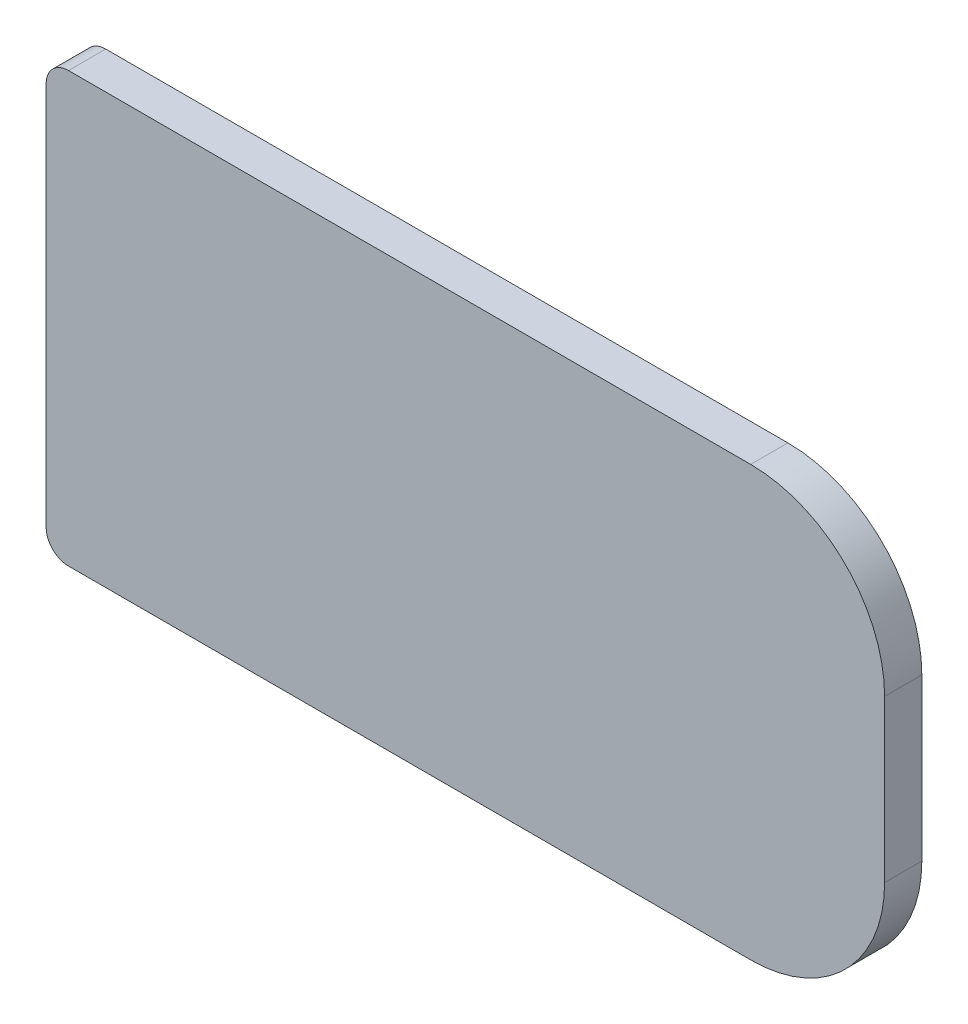
from build123d import *

# Parameters (mm, degrees)
BOSS_EXTRUDE1_DEPTH = 3


with BuildPart() as part:
    # Sketch1 → Boss-Extrude1 (new body)
    with BuildSketch(Plane.XY):
        with BuildLine():
            Line((23, 17.3), (-32, 17.3))
            ThreePointArc((-32, 17.3), (-33.272792206, 16.772792206), (-33.8, 15.5))
            Line((-33.8, 15.5), (-33.8, -15.5))
            ThreePointArc((-33.8, -15.5), (-33.272792206, -16.772792206), (-32, -17.3))
            Line((-32, -17.3), (23, -17.3))
            ThreePointArc((23, -17.3), (30.636753237, -14.136753237), (33.8, -6.5))
            Line((33.8, -6.5), (33.8, 6.5))
            ThreePointArc((33.8, 6.5), (30.636753237, 14.136753237), (23, 17.3))
        make_face()
    extrude(amount=BOSS_EXTRUDE1_DEPTH)


solid = part.part
